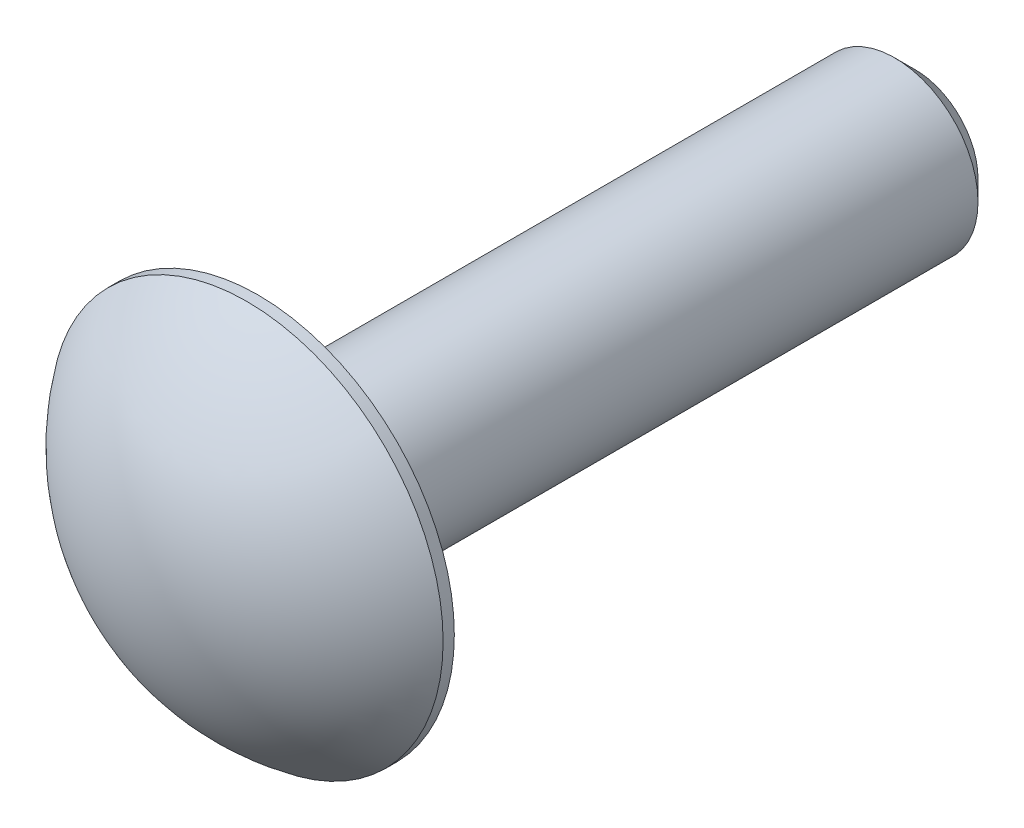
from build123d import *

# Parameters (mm, degrees)
SKETCH1_R            = 5.6896
EXTRUDE3_DEPTH       = 3.2512
SKETCH4_W            = 19.05
SKETCH4_H            = 2.413
CHAMFER2_SIZE        = 0.5953125
EXTRUDE13_REACH      = 22.68
EXTRUDE13_END_RADIUS = 6.994595556
SKETCH26_R           = 0.5461


with BuildPart() as part:
    # Sketch1 → Extrude3 (new body)
    with BuildSketch(Plane.XY):
        Circle(SKETCH1_R)
    extrude(amount=EXTRUDE3_DEPTH)

    # Sketch11 → Cut-Revolve3 (revolve, cut)
    with BuildSketch(Plane(origin=(0, 0, 0), x_dir=(0, 0, -1), z_dir=(1, 0, 0))):
        with BuildLine():
            Line((-3.5052, 6.82752), (0, 6.82752))
            Line((0, 6.82752), (0, 5.6896))
            Line((0, 5.6896), (-0.32512, 5.6896))
            ThreePointArc((-0.32512, 5.6896), (-2.476812954, 3.198964376), (-3.2512, 0))
            Line((-3.2512, 0), (-3.5052, 0))
            Line((-3.5052, 0), (-3.5052, 6.82752))
        make_face()
    revolve(axis=Axis((0, 0, 0), (0, 0, 1)), mode=Mode.SUBTRACT)



with BuildPart() as body_2:
    # Sketch4 → Revolve1 (revolve)
    with BuildSketch(Plane(origin=(0, 0, 0), x_dir=(0, 0, -1), z_dir=(1, 0, 0))):
        with Locations((9.525, 1.2065)):
            Rectangle(SKETCH4_W, SKETCH4_H)
    revolve(axis=Axis((0, 0, 0), (0, 0, -1)))

    # Chamfer2
    chamfer2_edges = [body_2.edges().sort_by_distance(p)[0] for p in [
        (0, -2.413, -19.05),
    ]]
    chamfer(chamfer2_edges, length=CHAMFER2_SIZE)


with BuildPart() as part_1:
    add(part.part)

    add(body_2.part)  # Extrude13 merges body 2
    # Extrude13: up to this sphere (the profile starts inside it)
    extrude13_end = Location((0, 0, -3.743395556)) * Sphere(EXTRUDE13_END_RADIUS, mode=Mode.PRIVATE)
    # Sketch26 → Extrude13 (add, up to the surface)
    with BuildSketch(Plane.XY, mode=Mode.PRIVATE) as extrude13_sk1:
        Circle(SKETCH26_R)
    extrude13_tool1 = extrude(extrude13_sk1.sketch, amount=EXTRUDE13_REACH, mode=Mode.PRIVATE) & extrude13_end
    add(extrude13_tool1.solids().sort_by_distance((0, 0, 0))[0])


solid = part_1.part
